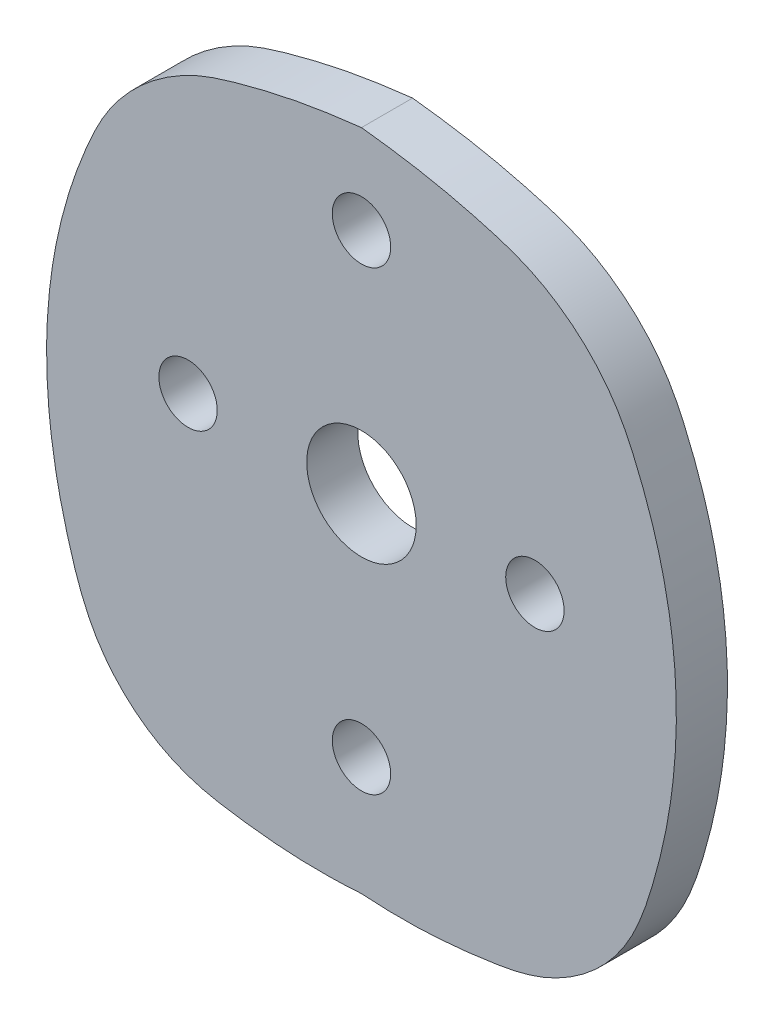
from build123d import *

# Parameters (mm, degrees)
SKETCH_1_R      = 3
SKETCH_1_R_2    = 1.6
EXTRUDE_1_DEPTH = 1.4


with BuildPart() as part:
    # Эскиз1 → Бобышка-Вытянуть1 (new, symmetric)
    with BuildSketch(Plane.XY):
        with BuildLine():
            add(Edge.make_bspline(
                [(0.001122719, 121.010798342), (-1.171537777, 120.878564334), (-2.920342404, 120.635017485), (-5.247011767, 120.138030638), (-6.946800778, 119.69382144), (-8.706962648, 119.152836869), (-10.946545964, 118.020539751), (-12.866852389, 116.358462009), (-14.110408646, 114.55076963), (-14.679815244, 113.428374891), (-15.154527423, 112.342274587), (-15.700764451, 110.9480002), (-16.422748754, 108.670349078), (-17.04602107, 105.737371487), (-17.32644385, 102.153144608), (-17.145523196, 98.567099912), (-16.645918818, 95.628814641), (-16.039061045, 93.319797301), (-15.5260557, 91.634852262), (-14.783897478, 89.88389692), (-13.350969306, 87.790887142), (-11.309708093, 86.171801095), (-9.23376402, 85.37848751), (-7.992173717, 85.10397433), (-6.829329308, 84.920254061), (-5.352810016, 84.730108117), (-2.981055745, 84.55218118), (-1.18943239, 84.580698193), (-0.001948516, 84.662753882)],
                knots=[-0.001640955, -0.001640955, -0.001640955, -0.001640955, 0.060897345, 0.092166496, 0.123435646, 0.154704796, 0.185973946, 0.248512247, 0.279781397, 0.295415973, 0.311050548, 0.342319698, 0.373588848, 0.436127149, 0.49866545, 0.56120375, 0.623742051, 0.655011201, 0.686280351, 0.717549502, 0.748818652, 0.811356953, 0.842626103, 0.858260678, 0.873895253, 0.905164404, 0.936433554, 0.998971855, 0.998971855, 0.998971855, 0.998971855], degree=3))
            add(Edge.make_bspline(
                [(-0.001948516, 84.662753882), (1.186405897, 84.574913724), (2.981520197, 84.553409912), (5.352882576, 84.72996369), (6.828933856, 84.920007559), (7.992486819, 85.10432361), (9.233850055, 85.378281966), (11.309773393, 86.171966045), (13.351203758, 87.791458364), (14.783942442, 89.883427402), (15.526120315, 91.636895952), (16.039409913, 93.320656443), (16.646093116, 95.630029551), (17.145598213, 98.567887787), (17.326583953, 102.154340228), (17.045346777, 105.738581877), (16.423176495, 108.669286984), (15.700645475, 110.947823695), (15.155239529, 112.341634894), (14.679791368, 113.42724638), (14.110834256, 114.550989633), (12.866935438, 116.357789729), (10.94687662, 118.02057599), (8.706999484, 119.152590802), (6.947014559, 119.693958367), (5.246499604, 120.138050756), (2.920641381, 120.635596611), (1.17271692, 120.875374778), (0.001122719, 121.010798342)],
                knots=[0.001027229, 0.001027229, 0.001027229, 0.001027229, 0.063565581, 0.094834756, 0.126103932, 0.14173852, 0.157373108, 0.188642284, 0.251180635, 0.282449811, 0.313718987, 0.344988162, 0.376257338, 0.438795689, 0.501334041, 0.563872392, 0.626410744, 0.657679919, 0.688949095, 0.704583683, 0.720218271, 0.751487447, 0.814025798, 0.845294974, 0.87656415, 0.907833325, 0.939102501, 1.001640852, 1.001640852, 1.001640852, 1.001640852], degree=3))
        make_face()
        with Locations((0, 103.636945021)):
            Circle(SKETCH_1_R, mode=Mode.SUBTRACT)
        with Locations((0.001338806, 116.136944949)):
            Circle(SKETCH_1_R_2, mode=Mode.SUBTRACT)
        with Locations((-9.5, 103.636945021)):
            Circle(SKETCH_1_R_2, mode=Mode.SUBTRACT)
        with Locations(Location((0.001338806, 91.136945092, 0), (0, 0, 180))):
            Circle(SKETCH_1_R_2, mode=Mode.SUBTRACT)
        with Locations(Location((9.502677611, 103.636945021, 0), (0, 0, 180))):
            Circle(SKETCH_1_R_2, mode=Mode.SUBTRACT)
    extrude(amount=EXTRUDE_1_DEPTH, both=True)


solid = part.part
